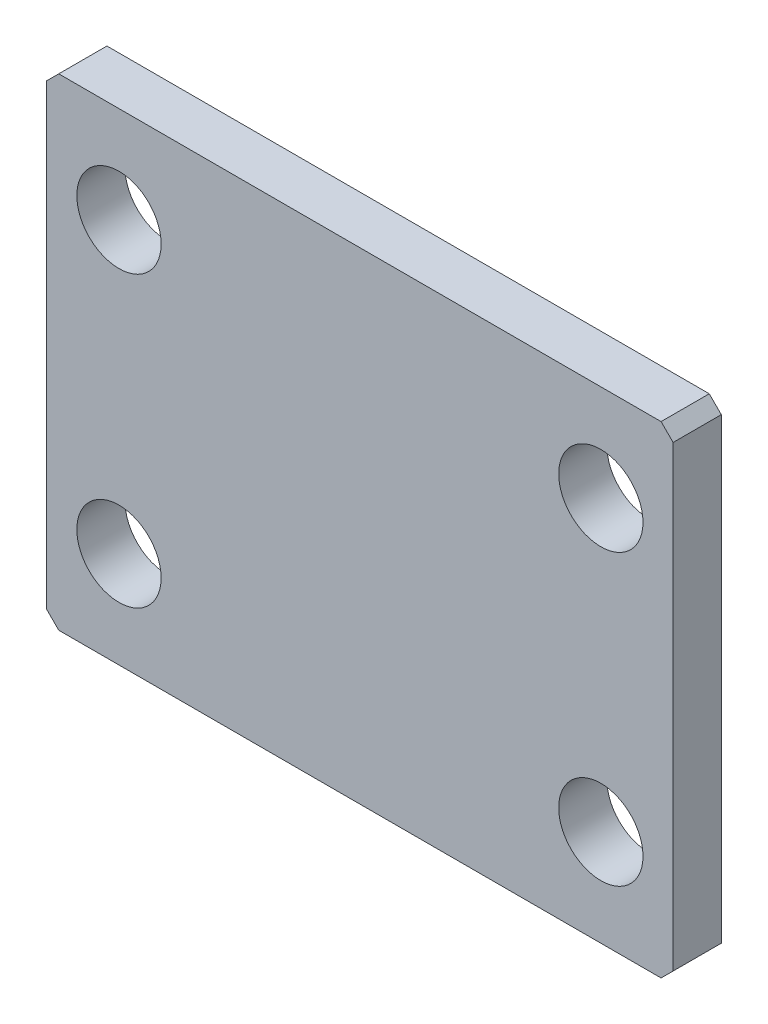
from build123d import *

# Parameters (mm, degrees)
BOSS_EXTRUDE1_DEPTH = 4
SKETCH2_R           = 3.5
CUT_EXTRUDE1_DEPTH  = 48.874836814


with BuildPart() as part:
    # Sketch1 → Boss-Extrude1 (new body)
    with BuildSketch(Plane.XY):
        Polygon((-25, 40), (25, 40), (26, 39), (26, 1), (25, 0), (-25, 0), (-26, 1), (-26, 39), align=None)
    extrude(amount=BOSS_EXTRUDE1_DEPTH)

    # Sketch2 → Cut-Extrude1 (cut, through all)
    with BuildSketch(Plane.XY.offset(4)):
        with Locations((20, 32)):
            Circle(SKETCH2_R)
        with Locations((-20, 32)):
            Circle(SKETCH2_R)
        with Locations((20, 8)):
            Circle(SKETCH2_R)
        with Locations((-20, 8)):
            Circle(SKETCH2_R)
    extrude(amount=-CUT_EXTRUDE1_DEPTH, mode=Mode.SUBTRACT)


solid = part.part
